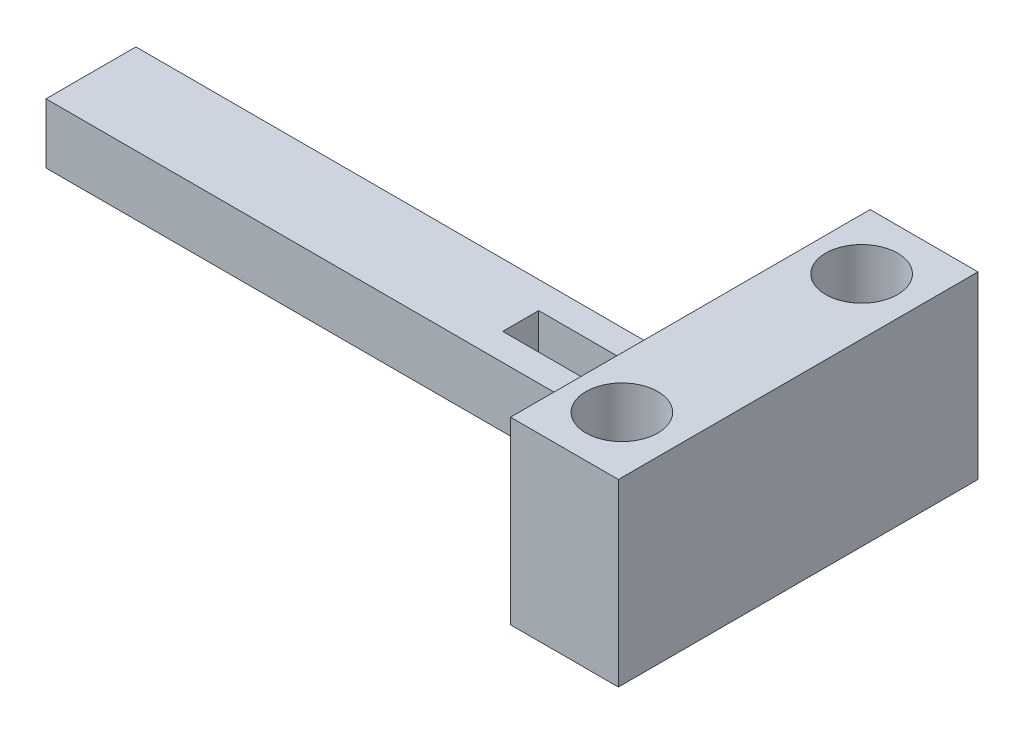
from build123d import *

# Parameters (mm, degrees)
SKETCH1_W           = 25.4
SKETCH1_H           = 3.81
SKETCH1_W_2         = 5.08
SKETCH1_H_2         = 1.524
BOSS_EXTRUDE1_DEPTH = 2.54
SKETCH3_W           = 15.24
SKETCH3_H           = 7.62
BOSS_EXTRUDE2_DEPTH = 4.572
SKETCH4_R           = 1.524
CUT_EXTRUDE1_DEPTH  = 21.358064348


with BuildPart() as part:
    # Sketch1 → Boss-Extrude1 (new body)
    with BuildSketch(Plane(origin=(0, 0, 0), x_dir=(1, 0, 0), z_dir=(0, 1, 0))):
        Rectangle(SKETCH1_W, SKETCH1_H)
        with Locations((8.052340426, 0)):
            Rectangle(SKETCH1_W_2, SKETCH1_H_2, mode=Mode.SUBTRACT)
    extrude(amount=BOSS_EXTRUDE1_DEPTH)

    # Sketch3 → Boss-Extrude2 (add)
    with BuildSketch(Plane(origin=(12.7, 0, 0), x_dir=(0, 0, -1), z_dir=(1, 0, 0))):
        with Locations((0, 2.602908147)):
            Rectangle(SKETCH3_W, SKETCH3_H)
    extrude(amount=BOSS_EXTRUDE2_DEPTH)

    # Sketch4 → Cut-Extrude1 (cut, through all)
    with BuildSketch(Plane(origin=(0, 6.412908147, 0), x_dir=(1, 0, 0), z_dir=(0, 1, 0))):
        with Locations(Location((14.879777227, -5.08, 0), (0, 0, 270))):
            Circle(SKETCH4_R)
        with Locations(Location((14.879777227, 5.08, 0), (0, 0, 90))):
            Circle(SKETCH4_R)
    extrude(amount=-CUT_EXTRUDE1_DEPTH, mode=Mode.SUBTRACT)


solid = part.part
